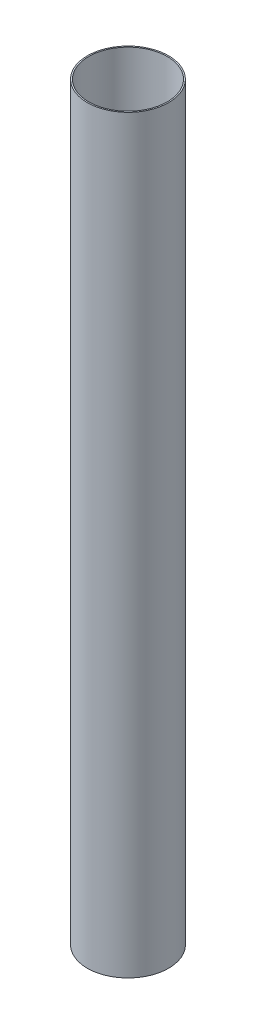
from build123d import *

# Parameters (mm, degrees)
SKETCH1_R           = 0.76
SKETCH1_R_2         = 0.735
BOSS_EXTRUDE1_DEPTH = 14.02


with BuildPart() as part:
    # Sketch1 → Boss-Extrude1 (new body)
    with BuildSketch(Plane(origin=(0, 0, 0), x_dir=(1, 0, 0), z_dir=(0, 1, 0))):
        with Locations(Location((0, 0, 0), (0, 0, 270))):
            Circle(SKETCH1_R)
        with Locations(Location((0, 0, 0), (0, 0, 270))):
            Circle(SKETCH1_R_2, mode=Mode.SUBTRACT)
    extrude(amount=BOSS_EXTRUDE1_DEPTH)


solid = part.part
